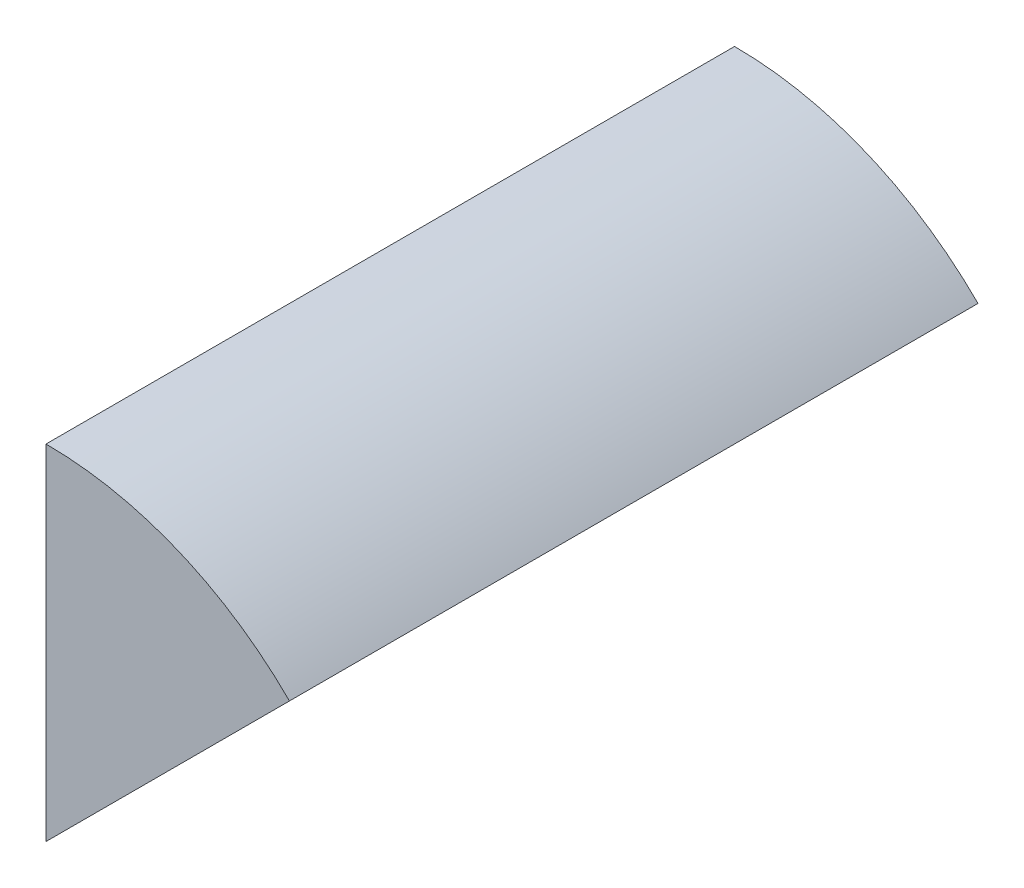
from build123d import *

# Parameters (mm, degrees)
SALIENTE_EXTRUIR1_DEPTH = 50
CROQUIS2_R              = 5
CORTAR_EXTRUIR1_DEPTH   = 10


with BuildPart() as part:
    # Croquis1 → Saliente-Extruir1 (new body)
    with BuildSketch(Plane.XY):
        with BuildLine():
            Line((0, 25), (0, 0))
            Line((0, 0), (17.67766953, 17.67766953))
            ThreePointArc((17.67766953, 17.67766953), (9.567085809, 23.096988313), (0, 25))
        make_face()
    extrude(amount=SALIENTE_EXTRUIR1_DEPTH)

    # Croquis2 → Cortar-Extruir1 (cut)
    with BuildSketch(Plane(origin=(0, 0, 0), x_dir=(-1, 0, 0), z_dir=(0, 0, -1))):
        with Locations((-6.714491582, 16.361123197)):
            Circle(CROQUIS2_R)
    extrude(amount=-CORTAR_EXTRUIR1_DEPTH, mode=Mode.SUBTRACT)


solid = part.part
